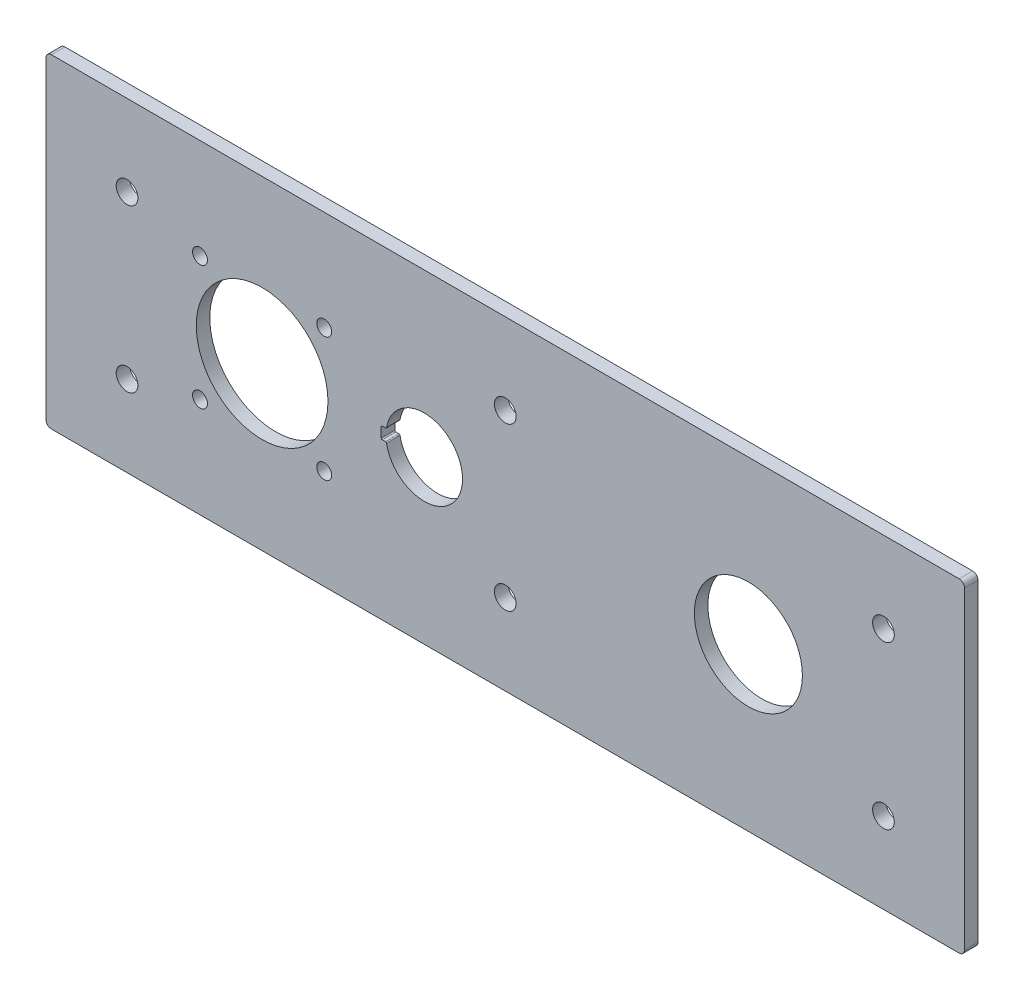
from build123d import *

# Parameters (mm, degrees)
SKETCH1_R             = 12.7
SKETCH1_R_2           = 15.4813
SKETCH1_R_3           = 2.5527
EXTRUDE1_DEPTH        = 3.175
F_6_32_TAPPED_HOLE1_D = 3.5052


with BuildPart() as part:
    # Sketch1 → Extrude1 (new body)
    with BuildSketch(Plane.XY):
        with BuildLine():
            Line((1.27, 38.1), (214.63, 38.1))
            ThreePointArc((214.63, 38.1), (215.528025612, 37.728025612), (215.9, 36.83))
            Line((215.9, 36.83), (215.9, -36.83))
            ThreePointArc((215.9, -36.83), (215.528025612, -37.728025612), (214.63, -38.1))
            Line((214.63, -38.1), (1.27, -38.1))
            ThreePointArc((1.27, -38.1), (0.371974388, -37.728025612), (0, -36.83))
            Line((0, -36.83), (0, 36.83))
            ThreePointArc((0, 36.83), (0.371974388, 37.728025612), (1.27, 38.1))
        make_face()
        with Locations((165.1, 0)):
            Circle(SKETCH1_R, mode=Mode.SUBTRACT)
        with Locations((50.8, 0)):
            Circle(SKETCH1_R_2, mode=Mode.SUBTRACT)
        with Locations((19.05, 19.05)):
            Circle(SKETCH1_R_3, mode=Mode.SUBTRACT)
        with Locations((196.85, 19.05)):
            Circle(SKETCH1_R_3, mode=Mode.SUBTRACT)
        with Locations(Location((196.85, -19.05, 0), (0, 0, 180))):
            Circle(SKETCH1_R_3, mode=Mode.SUBTRACT)
        with Locations(Location((19.05, -19.05, 0), (0, 0, 180))):
            Circle(SKETCH1_R_3, mode=Mode.SUBTRACT)
        with Locations((107.95, 19.05)):
            Circle(SKETCH1_R_3, mode=Mode.SUBTRACT)
        with Locations((107.95, -19.05)):
            Circle(SKETCH1_R_3, mode=Mode.SUBTRACT)
        with BuildLine():
            Line((79.790097811, 1.397), (79.0575, 1.397))
            ThreePointArc((79.0575, 1.397), (78.877894878, 1.322605122), (78.8035, 1.143))
            Line((78.8035, 1.143), (78.8035, -1.143))
            ThreePointArc((78.8035, -1.143), (78.877894878, -1.322605122), (79.0575, -1.397))
            Line((79.0575, -1.397), (79.790097811, -1.397))
            ThreePointArc((79.790097811, -1.397), (79.952903046, -1.456037297), (80.040026541, -1.605705075))
            ThreePointArc((80.040026541, -1.605705075), (97.9043, 0), (80.040026541, 1.605705075))
            ThreePointArc((80.040026541, 1.605705075), (79.952903046, 1.456037297), (79.790097811, 1.397))
        make_face(mode=Mode.SUBTRACT)
    extrude(amount=-EXTRUDE1_DEPTH)

    # #6-32 Tapped Hole1 (through all)
    with Locations(Plane.XY):
        with Locations((36.195, 14.605), (65.405, 14.605), (65.405, -14.605), (36.195, -14.605)):
            Hole(F_6_32_TAPPED_HOLE1_D / 2)


solid = part.part
